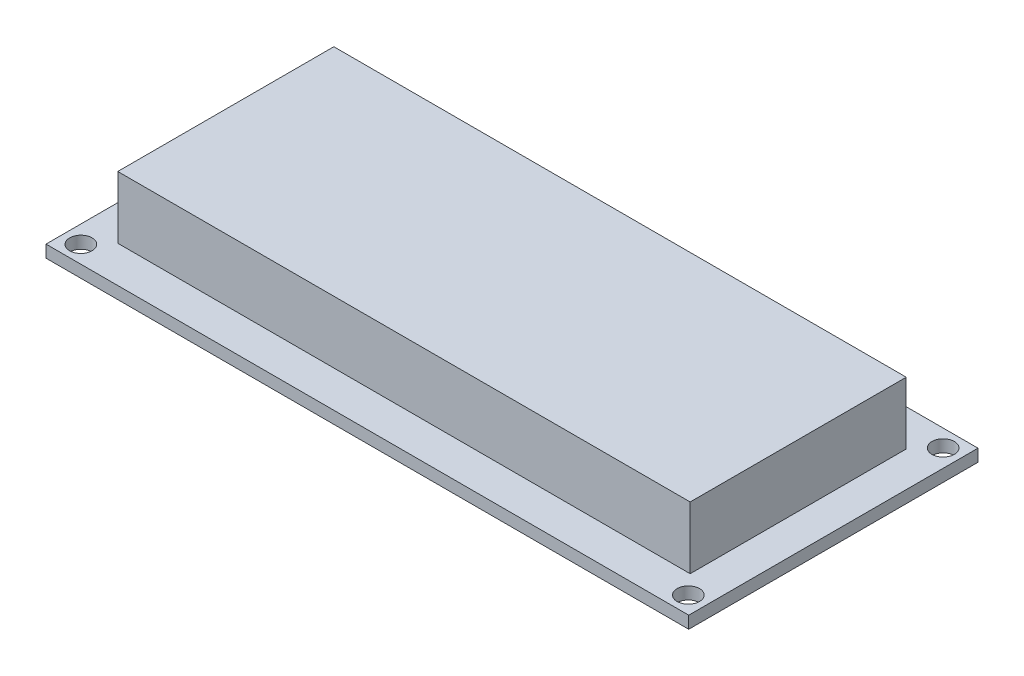
from build123d import *

# Parameters (mm, degrees)
SKETCH1_W      = 80.0862
SKETCH1_H      = 36.0426
EXTRUDE1_DEPTH = 1.524
SKETCH2_W      = 71.3232
SKETCH2_H      = 26.924
EXTRUDE2_DEPTH = 7.747
SKETCH3_R      = 1.397
EXTRUDE3_DEPTH = 45.589607761
SKETCH4_R      = 0.254
EXTRUDE4_DEPTH = 45.589607761


with BuildPart() as part:
    # Sketch1 → Extrude1 (new body)
    with BuildSketch(Plane(origin=(0, 0, 0), x_dir=(1, 0, 0), z_dir=(0, 1, 0))):
        Rectangle(SKETCH1_W, SKETCH1_H)
    extrude(amount=EXTRUDE1_DEPTH)

    # Sketch2 → Extrude2 (add)
    with BuildSketch(Plane(origin=(0, 1.524, 0), x_dir=(1, 0, 0), z_dir=(0, 1, 0))):
        Rectangle(SKETCH2_W, SKETCH2_H)
    extrude(amount=EXTRUDE2_DEPTH)

    # Sketch3 → Extrude3 (cut, through all)
    with BuildSketch(Plane(origin=(0, 1.524, 0), x_dir=(1, 0, 0), z_dir=(0, 1, 0))):
        with Locations(Location((-37.846, 15.875, 0), (0, 0, 270))):
            Circle(SKETCH3_R)
        with Locations(Location((37.846, 15.875, 0), (0, 0, 270))):
            Circle(SKETCH3_R)
        with Locations(Location((37.846, -15.875, 0), (0, 0, 270))):
            Circle(SKETCH3_R)
        with Locations(Location((-37.846, -15.875, 0), (0, 0, 270))):
            Circle(SKETCH3_R)
    extrude(amount=-EXTRUDE3_DEPTH, mode=Mode.SUBTRACT)

    # Sketch4 → Extrude4 (cut, through all)
    with BuildSketch(Plane(origin=(0, 1.524, 0), x_dir=(1, 0, 0), z_dir=(0, 1, 0))):
        with Locations(Location((-34.3281, 15.8877, 0), (0, 0, 270))):
            Circle(SKETCH4_R)
        with Locations(Location((-31.7881, 15.8877, 0), (0, 0, 270))):
            Circle(SKETCH4_R)
        with Locations(Location((-29.2481, 15.8877, 0), (0, 0, 270))):
            Circle(SKETCH4_R)
        with Locations(Location((-26.7081, 15.8877, 0), (0, 0, 270))):
            Circle(SKETCH4_R)
        with Locations(Location((-24.1681, 15.8877, 0), (0, 0, 270))):
            Circle(SKETCH4_R)
        with Locations(Location((-21.6281, 15.8877, 0), (0, 0, 270))):
            Circle(SKETCH4_R)
        with Locations(Location((-19.0881, 15.8877, 0), (0, 0, 270))):
            Circle(SKETCH4_R)
        with Locations(Location((-16.5481, 15.8877, 0), (0, 0, 270))):
            Circle(SKETCH4_R)
        with Locations(Location((-14.0081, 15.8877, 0), (0, 0, 270))):
            Circle(SKETCH4_R)
        with Locations(Location((-11.4681, 15.8877, 0), (0, 0, 270))):
            Circle(SKETCH4_R)
        with Locations(Location((-8.9281, 15.8877, 0), (0, 0, 270))):
            Circle(SKETCH4_R)
        with Locations(Location((-6.3881, 15.8877, 0), (0, 0, 270))):
            Circle(SKETCH4_R)
        with Locations(Location((-3.8481, 15.8877, 0), (0, 0, 270))):
            Circle(SKETCH4_R)
        with Locations(Location((-1.3081, 15.8877, 0), (0, 0, 270))):
            Circle(SKETCH4_R)
        with Locations(Location((1.2319, 15.8877, 0), (0, 0, 270))):
            Circle(SKETCH4_R)
        with Locations(Location((3.7719, 15.8877, 0), (0, 0, 270))):
            Circle(SKETCH4_R)
    extrude(amount=-EXTRUDE4_DEPTH, mode=Mode.SUBTRACT)


solid = part.part
